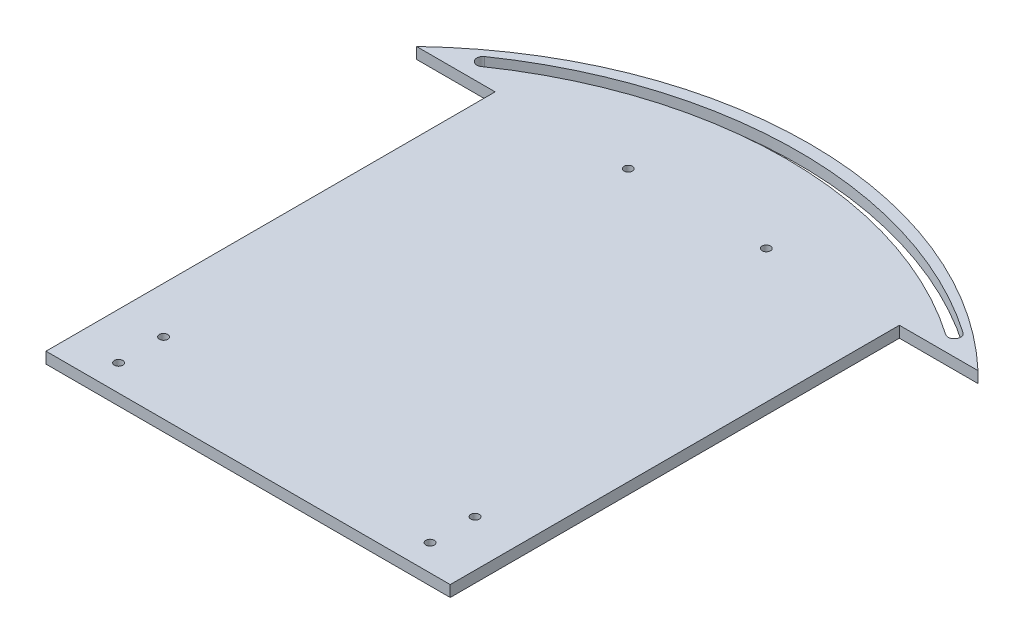
from build123d import *

# Parameters (mm, degrees)
ESQUISSE2_R        = 1.5
BOSS_EXTRU_1_DEPTH = 4


with BuildPart() as part:
    # Esquisse2 → Boss.-Extru.1 (new body)
    with BuildSketch(Plane(origin=(0, 0, 0), x_dir=(1, 0, 0), z_dir=(0, 1, 0))):
        with BuildLine():
            Line((0, 0), (28, 0))
            Line((28, 0), (28, -160))
            Line((28, -160), (172, -160))
            Line((172, -160), (172, 0))
            Line((172, 0), (200, 0))
            ThreePointArc((200, 0), (100, 40), (0, 0))
        make_face()
        with Locations(Location((44.519959109, -134.645808038, 0), (0, 0, 270))):
            Circle(ESQUISSE2_R, mode=Mode.SUBTRACT)
        with Locations(Location((44.519959109, -150.668405535, 0), (0, 0, 270))):
            Circle(ESQUISSE2_R, mode=Mode.SUBTRACT)
        with Locations(Location((155.480040891, -150.668405535, 0), (0, 0, 90))):
            Circle(ESQUISSE2_R, mode=Mode.SUBTRACT)
        with Locations(Location((155.480040891, -134.645808038, 0), (0, 0, 90))):
            Circle(ESQUISSE2_R, mode=Mode.SUBTRACT)
        with Locations(Location((75.412395646, 0, 0), (0, 0, 270))):
            Circle(ESQUISSE2_R, mode=Mode.SUBTRACT)
        with Locations(Location((124.587604354, 0, 0), (0, 0, 90))):
            Circle(ESQUISSE2_R, mode=Mode.SUBTRACT)
        with BuildLine():
            ThreePointArc((185.657545612, 9.025506382), (100.445588201, 35.657742009), (15.23363079, 9.025506382))
            ThreePointArc((15.23363079, 9.025506382), (14.672053701, 5.931560858), (17.765999225, 5.369983769))
            ThreePointArc((17.765999225, 5.369983769), (100.445588201, 31.210750277), (183.125177177, 5.369983769))
            ThreePointArc((183.125177177, 5.369983769), (186.219122701, 5.931560858), (185.657545612, 9.025506382))
        make_face(mode=Mode.SUBTRACT)
    extrude(amount=BOSS_EXTRU_1_DEPTH)


solid = part.part
